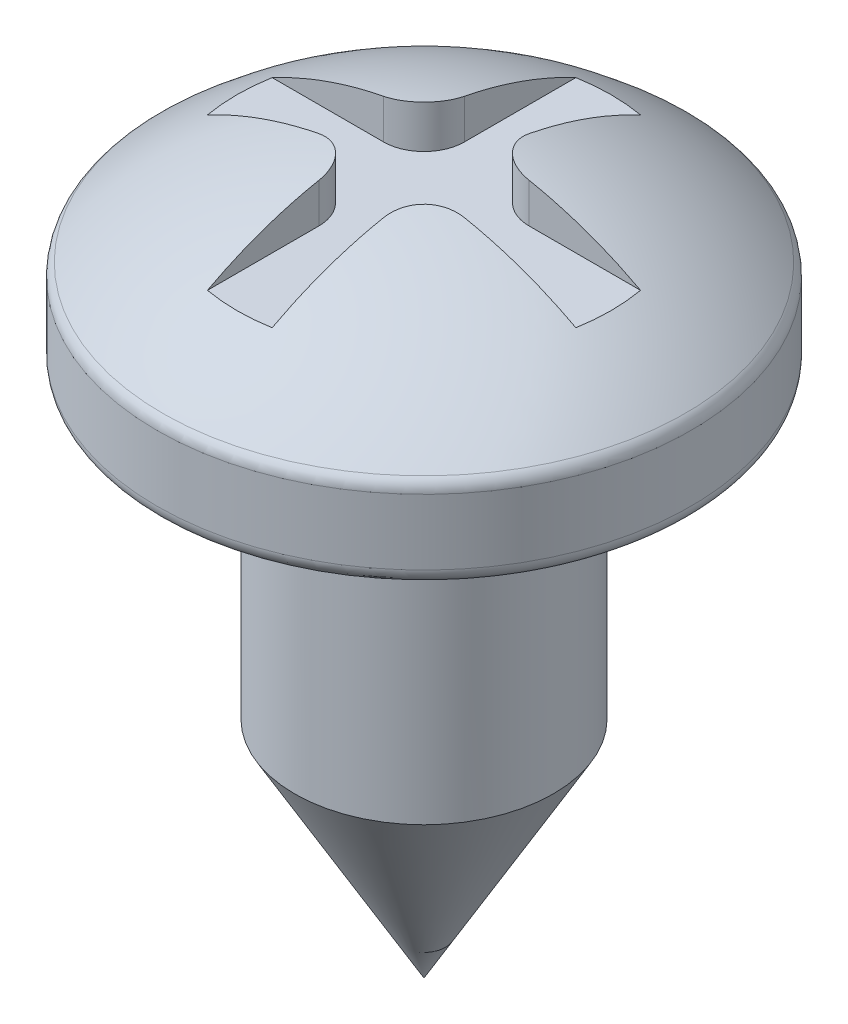
from build123d import *

# Parameters (mm, degrees)
CORTAR_EXTRUIR1_START = -1.8
CORTAR_EXTRUIR1_DEPTH = 3


with BuildPart() as part:
    # Croquis1 → Revolución1 (revolve)
    with BuildSketch(Plane.XY, mode=Mode.PRIVATE) as revoluci_n1_sk:
        with BuildLine():
            Line((0, 0), (0, 8.9))
            ThreePointArc((0, 8.9), (1.726548348, 8.569000929), (3.231811568, 7.660864252))
            ThreePointArc((3.231811568, 7.660864252), (3.282156956, 7.593022088), (3.3, 7.5104458))
            Line((3.3, 7.5104458), (3.3, 6.7))
            ThreePointArc((3.3, 6.7), (3.241421356, 6.558578644), (3.1, 6.5))
            Line((3.1, 6.5), (1.6, 6.5))
            Line((1.6, 6.5), (1.6, 2.771281292))
            Line((1.6, 2.771281292), (0, 0))
        make_face()
    revolve(revoluci_n1_sk.sketch.rotate(Axis((0, 0, 0), (0, 1, 0)), 90), axis=Axis((0, 0, 0), (0, 1, 0)))

    # Croquis2 → Cortar-Extruir1 (cut)
    with BuildSketch(Plane.XZ.offset(-6.5).offset(CORTAR_EXTRUIR1_START)):
        with BuildLine():
            Line((-0.4, 3.2), (-0.4, 0.9))
            ThreePointArc((-0.4, 0.9), (-0.546446609, 0.546446609), (-0.9, 0.4))
            Line((-0.9, 0.4), (-3.2, 0.4))
            Line((-3.2, 0.4), (-3.2, -0.4))
            Line((-3.2, -0.4), (-0.9, -0.4))
            ThreePointArc((-0.9, -0.4), (-0.546446609, -0.546446609), (-0.4, -0.9))
            Line((-0.4, -0.9), (-0.4, -3.2))
            Line((-0.4, -3.2), (0.4, -3.2))
            Line((0.4, -3.2), (0.4, -0.9))
            ThreePointArc((0.4, -0.9), (0.546446609, -0.546446609), (0.9, -0.4))
            Line((0.9, -0.4), (3.2, -0.4))
            Line((3.2, -0.4), (3.2, 0.4))
            Line((3.2, 0.4), (0.9, 0.4))
            ThreePointArc((0.9, 0.4), (0.546446609, 0.546446609), (0.4, 0.9))
            Line((0.4, 0.9), (0.4, 3.2))
            Line((0.4, 3.2), (-0.4, 3.2))
        make_face()
    extrude(amount=-CORTAR_EXTRUIR1_DEPTH, mode=Mode.SUBTRACT)


solid = part.part
